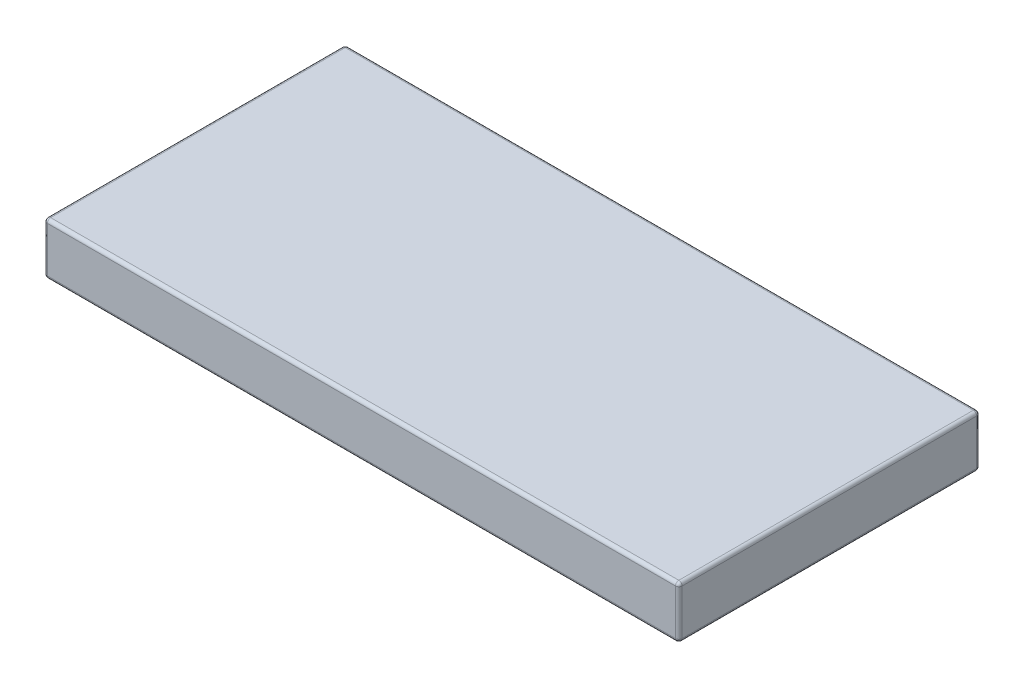
from build123d import *

# Parameters (mm, degrees)
SKETCH1_W           = 19.14
SKETCH1_H           = 9.08
BOSS_EXTRUDE1_DEPTH = 1.57
FILLET1_R           = 0.1


with BuildPart() as part:
    # Sketch1 → Boss-Extrude1 (new body)
    with BuildSketch(Plane(origin=(0, 0, 0), x_dir=(1, 0, 0), z_dir=(0, 1, 0))):
        Rectangle(SKETCH1_W, SKETCH1_H)
    extrude(amount=BOSS_EXTRUDE1_DEPTH)

    # Fillet1
    fillet1_edges = [part.edges().sort_by_distance(p)[0] for p in [
        (-9.57, 1.57, 0),
        (0, 1.57, 4.54),
        (9.57, 1.57, 0),
        (0, 0, 4.54),
        (-9.57, 0, 0),
        (0, 0, -4.54),
        (9.57, 0, 0),
        (9.57, 0.785, 4.54),
        (-9.57, 0.785, 4.54),
        (-9.57, 0.785, -4.54),
        (9.57, 0.785, -4.54),
        (0, 1.57, -4.54),
    ]]
    fillet(fillet1_edges, radius=FILLET1_R)


solid = part.part
